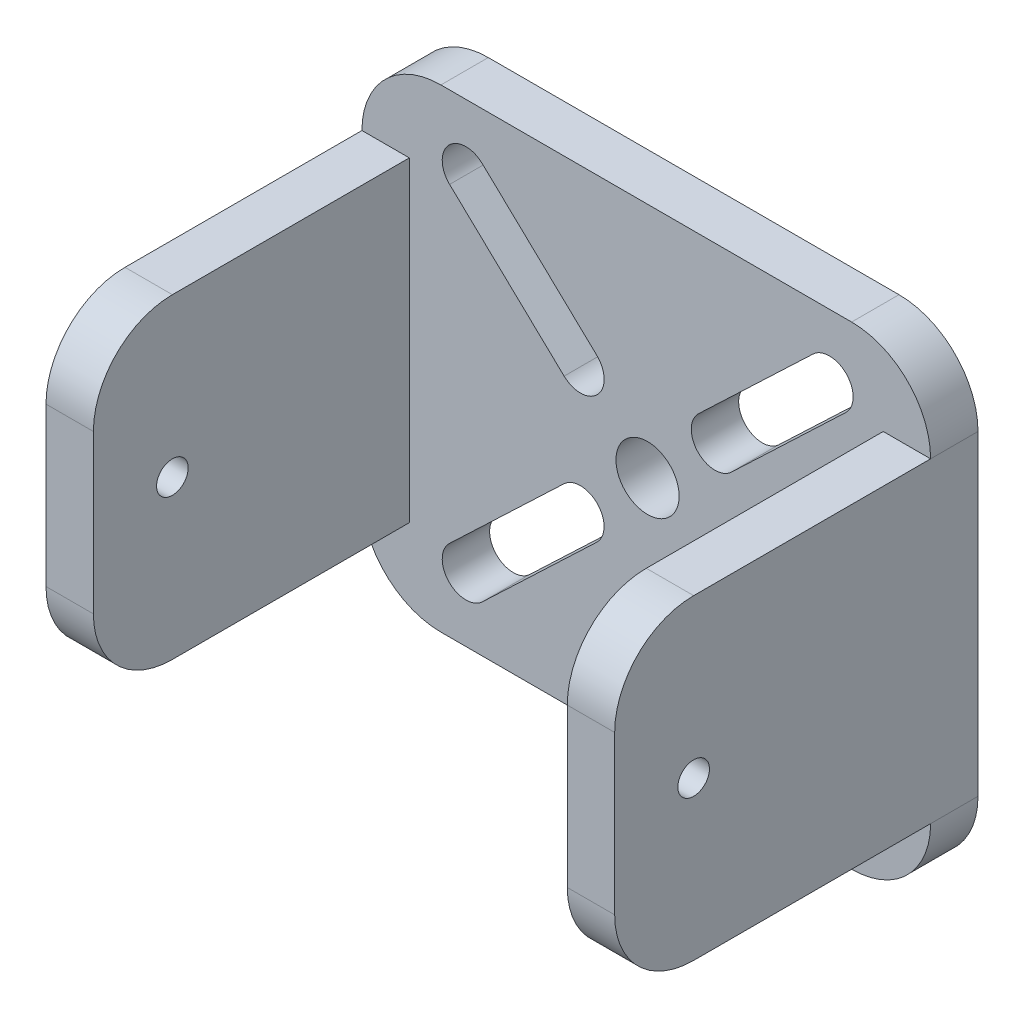
from build123d import *

# Parameters (mm, degrees)
SKETCH1_W           = 36
SKETCH1_H           = 30
SKETCH1_R           = 2
BOSS_EXTRUDE2_DEPTH = 3
SKETCH2_R           = 1
BOSS_EXTRUDE3_DEPTH = 3
BOSS_EXTRUDE4_START = -3
SKETCH3_R           = 1
BOSS_EXTRUDE4_DEPTH = 3
FILLET1_R           = 5


with BuildPart() as part:
    # Sketch1 → Boss-Extrude2 (new body)
    with BuildSketch(Plane.XY):
        with Locations((18, 15)):
            Rectangle(SKETCH1_W, SKETCH1_H)
        with Locations((18.080429635, 14.989140404)):
            Circle(SKETCH1_R, mode=Mode.SUBTRACT)
        with BuildLine():
            Line((30.628958922, 24.853393036), (23.382773138, 17.961891633))
            ThreePointArc((23.382773138, 17.961891633), (21.26212006, 18.01509429), (21.315322717, 20.135747368))
            Line((21.315322717, 20.135747368), (28.561508501, 27.027248771))
            ThreePointArc((28.561508501, 27.027248771), (30.682161579, 26.974046114), (30.628958922, 24.853393036))
        make_face(mode=Mode.SUBTRACT)
        with BuildLine():
            Line((23.38198698, 12.023010255), (30.633153673, 5.136749906))
            ThreePointArc((30.633153673, 5.136749906), (30.687889624, 3.016135849), (28.567275568, 2.961399898))
            Line((28.567275568, 2.961399898), (21.316108876, 9.847660248))
            ThreePointArc((21.316108876, 9.847660248), (21.261372924, 11.968274304), (23.38198698, 12.023010255))
        make_face(mode=Mode.SUBTRACT)
        with BuildLine():
            Line((14.862197308, 9.858378688), (7.616011524, 2.966877285))
            ThreePointArc((7.616011524, 2.966877285), (5.495358446, 3.020079942), (5.548561103, 5.14073302))
            Line((5.548561103, 5.14073302), (12.794746887, 12.032234423))
            ThreePointArc((12.794746887, 12.032234423), (14.915399965, 11.979031766), (14.862197308, 9.858378688))
        make_face(mode=Mode.SUBTRACT)
        with BuildLine():
            Line((7.615225366, 26.996328337), (14.866392058, 20.110067987))
            ThreePointArc((14.866392058, 20.110067987), (14.92112801, 17.989453931), (12.800513954, 17.934717979))
            Line((12.800513954, 17.934717979), (5.549347261, 24.820978329))
            ThreePointArc((5.549347261, 24.820978329), (5.49461131, 26.941592385), (7.615225366, 26.996328337))
        make_face(mode=Mode.SUBTRACT)
    extrude(amount=BOSS_EXTRUDE2_DEPTH)

    # Sketch2 → Boss-Extrude3 (add)
    with BuildSketch(Plane(origin=(36, 0, 0), x_dir=(0, 0, -1), z_dir=(1, 0, 0))):
        with BuildLine():
            Line((-18, 5), (-3, 5))
            Line((-3, 5), (-3, 25))
            Line((-3, 25), (-18, 25))
            ThreePointArc((-18, 25), (-21.535533906, 23.535533906), (-23, 20))
            Line((-23, 20), (-23, 10))
            ThreePointArc((-23, 10), (-21.535533906, 6.464466094), (-18, 5))
        make_face()
        with Locations((-18, 15)):
            Circle(SKETCH2_R, mode=Mode.SUBTRACT)
    extrude(amount=-BOSS_EXTRUDE3_DEPTH)

    # Sketch3 → Boss-Extrude4 (add)
    with BuildSketch(Plane.ZY.offset(BOSS_EXTRUDE4_START)):
        with BuildLine():
            Line((3, 25), (18, 25))
            ThreePointArc((18, 25), (21.535533906, 23.535533906), (23, 20))
            Line((23, 20), (23, 10))
            ThreePointArc((23, 10), (21.535533906, 6.464466094), (18, 5))
            Line((18, 5), (3, 5))
            Line((3, 5), (3, 25))
        make_face()
        with Locations(Location((18, 15, 0), (0, 0, 180))):
            Circle(SKETCH3_R, mode=Mode.SUBTRACT)
    extrude(amount=BOSS_EXTRUDE4_DEPTH)

    # Fillet1
    fillet1_edges = [part.edges().sort_by_distance(p)[0] for p in [
        (36, 30, 1.5),
        (0, 30, 1.5),
        (0, 0, 1.5),
        (36, 0, 1.5),
    ]]
    fillet(fillet1_edges, radius=FILLET1_R)


solid = part.part
